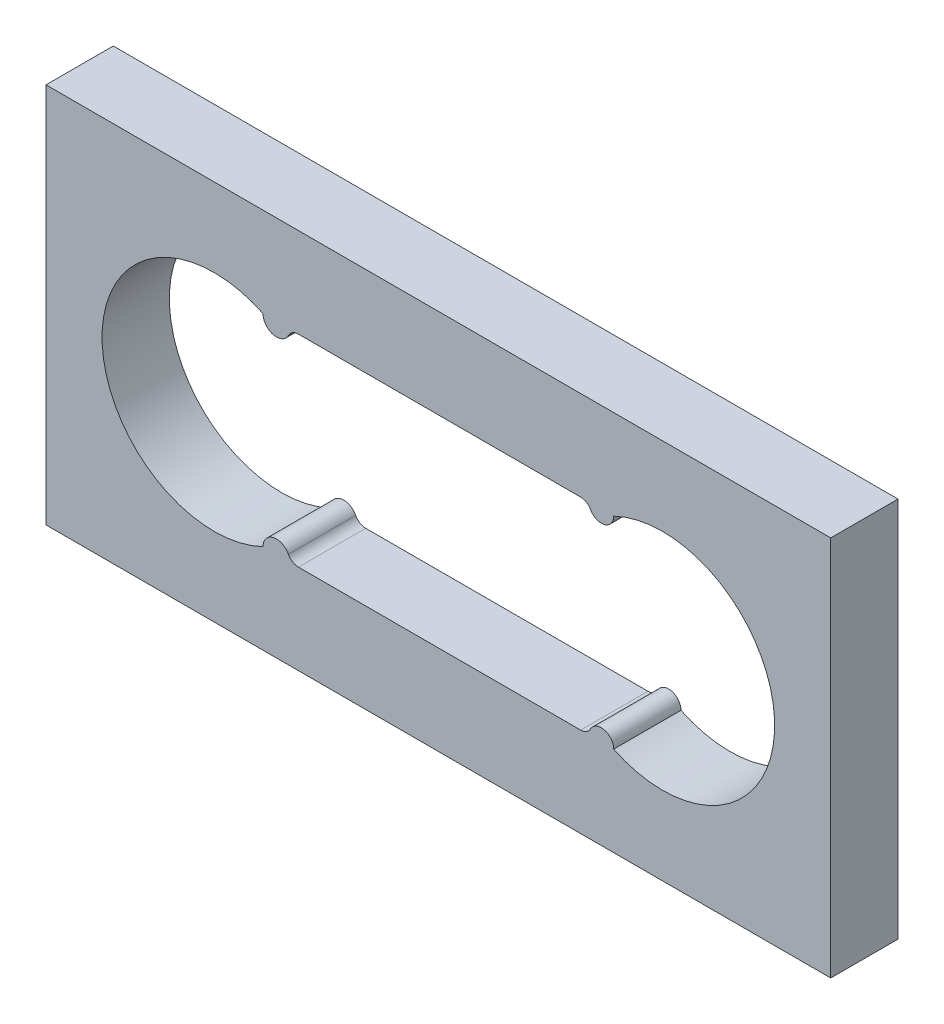
from build123d import *

# Parameters (mm, degrees)
SKETCH_1_W      = 35
SKETCH_1_H      = 17
EXTRUDE_1_DEPTH = 3
SKETCH_2_R      = 0.6
SKETCH_2_R_2    = 0.55
EXTRUDE_2_DEPTH = 3
FILLET_1_R      = 0.5


with BuildPart() as part:
    # 스케치1 → 보스-돌출1 (new body)
    with BuildSketch(Plane.XY):
        Rectangle(SKETCH_1_W, SKETCH_1_H)
        with BuildLine():
            Line((7.820550528, -4.5), (-7.820550528, -4.5))
            ThreePointArc((-7.820550528, -4.5), (-15, 0), (-7.820550528, 4.5))
            Line((-7.820550528, 4.5), (7.820550528, 4.5))
            ThreePointArc((7.820550528, 4.5), (12.655442773, 4.236581603), (15, 0))
            ThreePointArc((15, 0), (12.655442773, -4.236581603), (7.820550528, -4.5))
        make_face(mode=Mode.SUBTRACT)
    extrude(amount=EXTRUDE_1_DEPTH)

    # 스케치2 → 보스-돌출2 (add)
    with BuildSketch(Plane.XY.offset(3)):
        with Locations((-7.220550528, 4.5)):
            Circle(SKETCH_2_R)
        with Locations((-7.220550528, -4.5)):
            Circle(SKETCH_2_R)
        with Locations((7.270550528, -4.5)):
            Circle(SKETCH_2_R_2)
        with Locations((7.270550528, 4.5)):
            Circle(SKETCH_2_R_2)
    extrude(amount=-EXTRUDE_2_DEPTH)

    # 필렛1
    fillet_1_edges = [part.edges().sort_by_distance(p)[0] for p in [
        (-6.620550528, 4.5, 1.5),
        (-6.620550528, -4.5, 1.5),
        (6.720550528, -4.5, 1.5),
        (6.720550528, 4.5, 1.5),
    ]]
    fillet(fillet_1_edges, radius=FILLET_1_R)


solid = part.part
